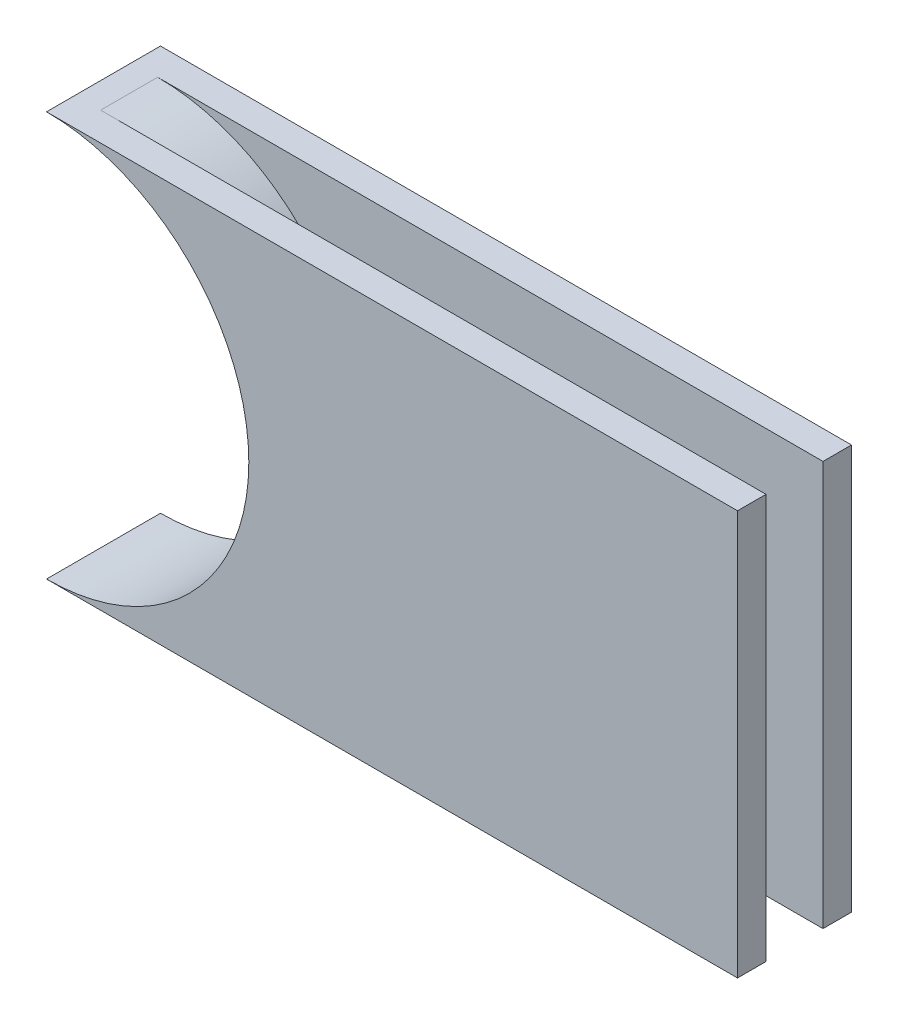
from build123d import *

# Parameters (mm, degrees)
SKETCH1_R               = 19.939
CIRCLE_EXTRUDE_DEPTH    = 7.62
SKETCH3_W               = 7.62
SKETCH3_H               = 39.878
RECTANGLE_EXTRUDE_DEPTH = 63.5
SKETCH2_R               = 18.034
CRICLE_CUT_DEPTH        = 67.991627245
SKETCH4_OUTSIDE_W       = 103.997
SKETCH4_OUTSIDE_H       = 60.436
SKETCH4_OUTSIDE_W_2     = 61.595
SKETCH4_OUTSIDE_H_2     = 36.068
FRAME_CUT_DEPTH         = 67.991627245
EXTENSION_DEPTH         = 2.54
SKETCH11_W              = 5.08
SKETCH11_H              = 36.068
MIDDLE_DEPTH            = 46.682766784
SKETCH12_OUTSIDE_W      = 78.015
SKETCH12_OUTSIDE_H      = 52.488
CIRCLE_EXTENSION_DEPTH  = 5.08


with BuildPart() as part:
    # Sketch1 → circle extrude (new body)
    with BuildSketch(Plane.XY):
        with Locations(Location((0, 0, 0), (0, 0, 180))):
            Circle(SKETCH1_R)
    extrude(amount=CIRCLE_EXTRUDE_DEPTH)

    # Sketch3 → rectangle extrude (add)
    with BuildSketch(Plane(origin=(0, 0, 0), x_dir=(0, 0, -1), z_dir=(1, 0, 0))):
        with Locations((-3.81, 0)):
            Rectangle(SKETCH3_W, SKETCH3_H)
    extrude(amount=RECTANGLE_EXTRUDE_DEPTH)

    # Sketch2 → cricle cut (cut, through all)
    with BuildSketch(Plane.XY.offset(7.62)):
        Circle(SKETCH2_R)
    extrude(amount=-CRICLE_CUT_DEPTH, mode=Mode.SUBTRACT)

    # Sketch4 outside → frame cut (cut, through all)
    with BuildSketch(Plane.XY.offset(7.62)):
        with Locations((21.7805, 0)):
            Rectangle(SKETCH4_OUTSIDE_W, SKETCH4_OUTSIDE_H)
        with Locations((30.7975, 0)):
            Rectangle(SKETCH4_OUTSIDE_W_2, SKETCH4_OUTSIDE_H_2, mode=Mode.SUBTRACT)
    extrude(amount=-FRAME_CUT_DEPTH, mode=Mode.SUBTRACT)

    # Sketch10 → extension (add)
    with BuildSketch(Plane(origin=(0, 0, 0), x_dir=(-1, 0, 0), z_dir=(0, 0, -1))):
        with BuildLine():
            Line((0, 18.034), (-61.595, 18.034))
            Line((-61.595, 18.034), (-61.595, -18.034))
            Line((-61.595, -18.034), (0, -18.034))
            ThreePointArc((0, -18.034), (-18.034, 0), (0, 18.034))
        make_face()
    extrude(amount=EXTENSION_DEPTH)

    # Sketch11 → middle (cut, through all)
    with BuildSketch(Plane(origin=(20.32, 0, 0), x_dir=(0, 0, -1), z_dir=(1, 0, 0))):
        with Locations((-2.54, 0)):
            Rectangle(SKETCH11_W, SKETCH11_H)
    extrude(amount=MIDDLE_DEPTH, mode=Mode.SUBTRACT)

    # Sketch12 outside → circle extension (cut)
    with BuildSketch(Plane.XY):
        with Locations((30.7975, 0)):
            Rectangle(SKETCH12_OUTSIDE_W, SKETCH12_OUTSIDE_H)
        with BuildLine():
            Line((2.286, 18.034), (0, 18.034))
            Line((0, 18.034), (0, -18.034))
            Line((0, -18.034), (2.286, -18.034))
            ThreePointArc((2.286, -18.034), (20.32, 0), (2.286, 18.034))
        make_face(mode=Mode.SUBTRACT)
    extrude(amount=CIRCLE_EXTENSION_DEPTH, mode=Mode.SUBTRACT)


solid = part.part
